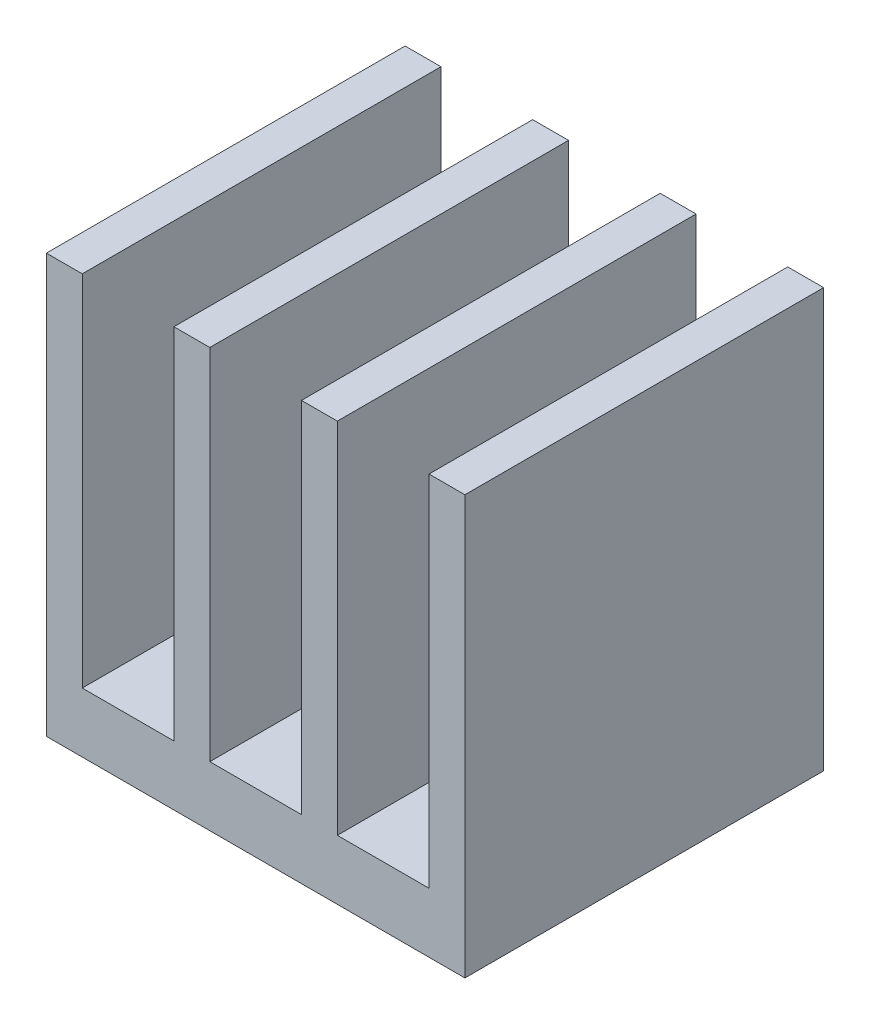
from build123d import *

# Parameters (mm, degrees)
BOSS_EXTRUDE1_DEPTH = 6


with BuildPart() as part:
    # Sketch1 → Boss-Extrude1 (new body)
    with BuildSketch(Plane.XY):
        Polygon((-3.5, 0), (3.5, 0), (3.5, 7), (2.9, 7), (2.9, 1), (1.366666667, 1), (1.366666667, 7), (0.766666667, 7), (0.766666667, 1), (-0.766666667, 1), (-0.766666667, 7), (-1.366666667, 7), (-1.366666667, 1), (-2.9, 1), (-2.9, 7), (-3.5, 7), align=None)
    extrude(amount=BOSS_EXTRUDE1_DEPTH)


solid = part.part
